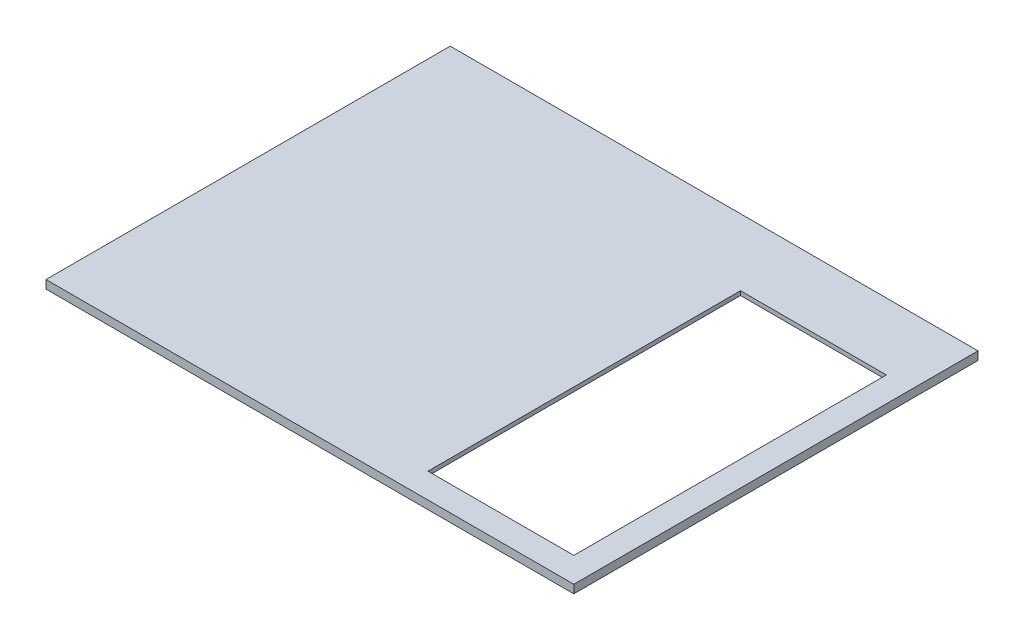
from build123d import *

# Parameters (mm, degrees)
SKETCH_1_W          = 380
SKETCH_1_H          = 291
EXTRUDE_1_DEPTH     = 3
SKETCH_2_W          = 380
SKETCH_2_H          = 291
SKETCH_2_W_2        = 344
SKETCH_2_H_2        = 255
EXTRUDE_3_DEPTH     = 3
SKETCH_7_W          = 105
SKETCH_7_H          = 225
CUT_EXTRUDE_1_DEPTH = 3


with BuildPart() as part:
    # Эскиз1 → Бобышка-Вытянуть1 (new body)
    with BuildSketch(Plane(origin=(0, 0, 0), x_dir=(1, 0, 0), z_dir=(0, 1, 0))):
        Rectangle(SKETCH_1_W, SKETCH_1_H)
    extrude(amount=EXTRUDE_1_DEPTH)

    # Эскиз2 → Бобышка-Вытянуть3 (add)
    with BuildSketch(Plane.XZ):
        Rectangle(SKETCH_2_W, SKETCH_2_H)
        Rectangle(SKETCH_2_W_2, SKETCH_2_H_2, mode=Mode.SUBTRACT)
    extrude(amount=EXTRUDE_3_DEPTH)

    # Эскиз7 → Вырез-Вытянуть1 (cut)
    with BuildSketch(Plane.XZ):
        with Locations((119.5, 15)):
            Rectangle(SKETCH_7_W, SKETCH_7_H)
    extrude(amount=-CUT_EXTRUDE_1_DEPTH, mode=Mode.SUBTRACT)


solid = part.part
